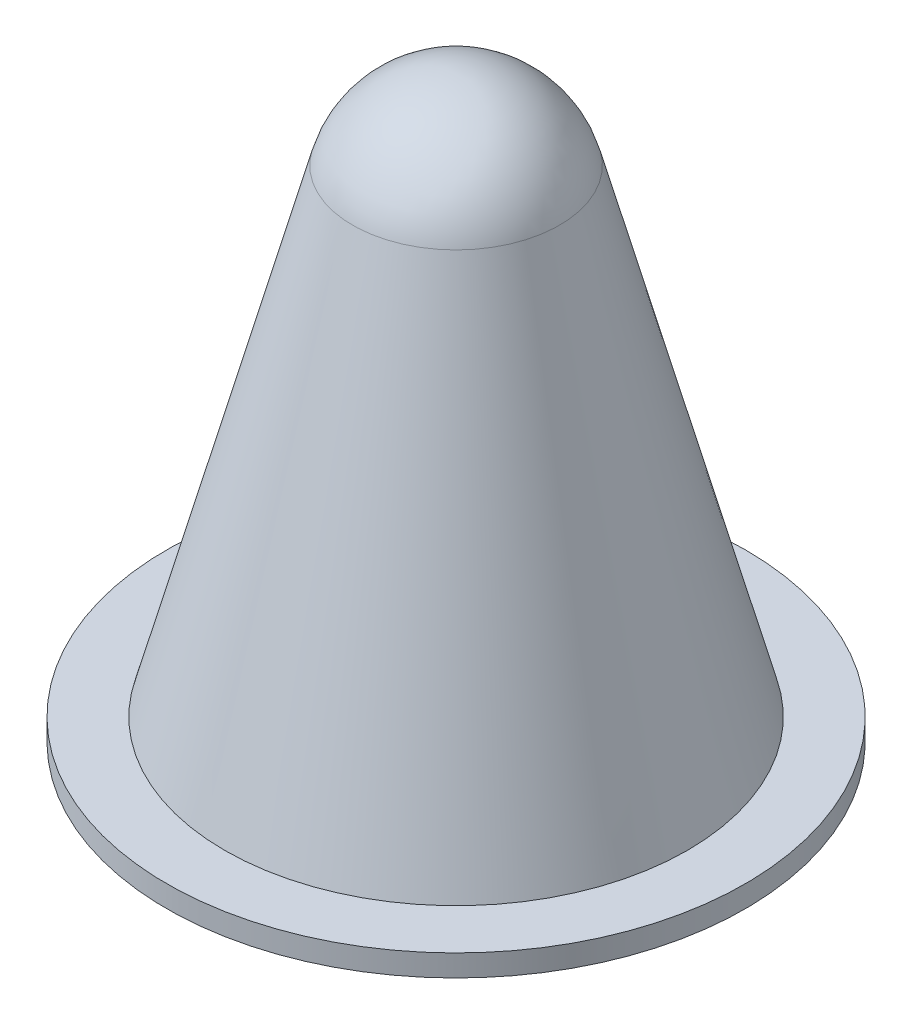
from build123d import *


with BuildPart() as part:
    # 草图2 → 旋转1 (revolve)
    with BuildSketch(Plane.XY, mode=Mode.PRIVATE) as revolve_1_sk:
        with BuildLine():
            Line((-14.310144359, 3.834391625), (-32, -62.185048407))
            Line((-32, -62.185048407), (-40, -62.185048407))
            Line((-40, -62.185048407), (-40, -65.185048407))
            Line((-40, -65.185048407), (0, -65.185048407))
            Line((0, -65.185048407), (0, 14.814951593))
            ThreePointArc((0, 14.814951593), (-9.018771102, 11.753491332), (-14.310144359, 3.834391625))
        make_face()
    revolve(revolve_1_sk.sketch.rotate(Axis((0, -65.185048407, 0), (0, 1, 0)), 270), axis=Axis((0, -65.185048407, 0), (0, 1, 0)))


solid = part.part
